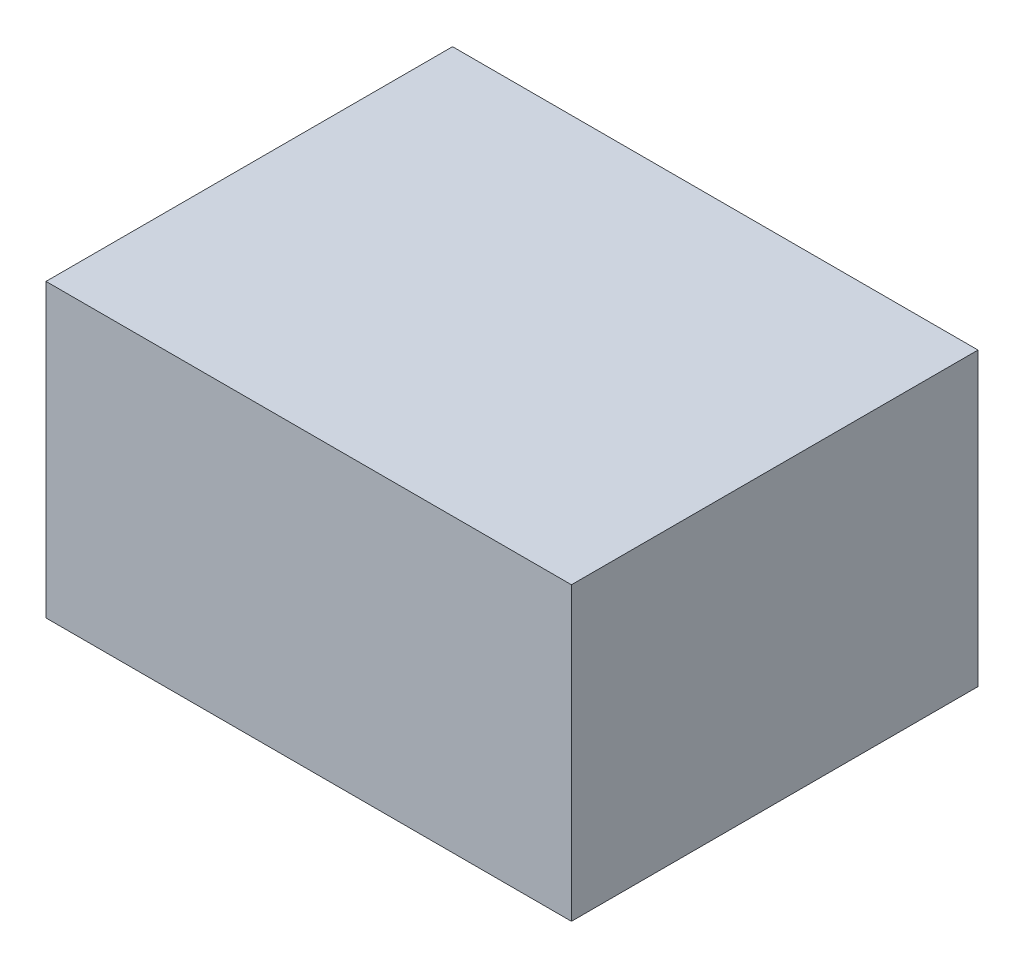
from build123d import *

# Parameters (mm, degrees)
SKETCH1_W           = 68.5
SKETCH1_H           = 53
BOSS_EXTRUDE1_DEPTH = 38


with BuildPart() as part:
    # Sketch1 → Boss-Extrude1 (new body)
    with BuildSketch(Plane(origin=(0, 0, 0), x_dir=(1, 0, 0), z_dir=(0, 1, 0))):
        Rectangle(SKETCH1_W, SKETCH1_H)
    extrude(amount=BOSS_EXTRUDE1_DEPTH)


solid = part.part
